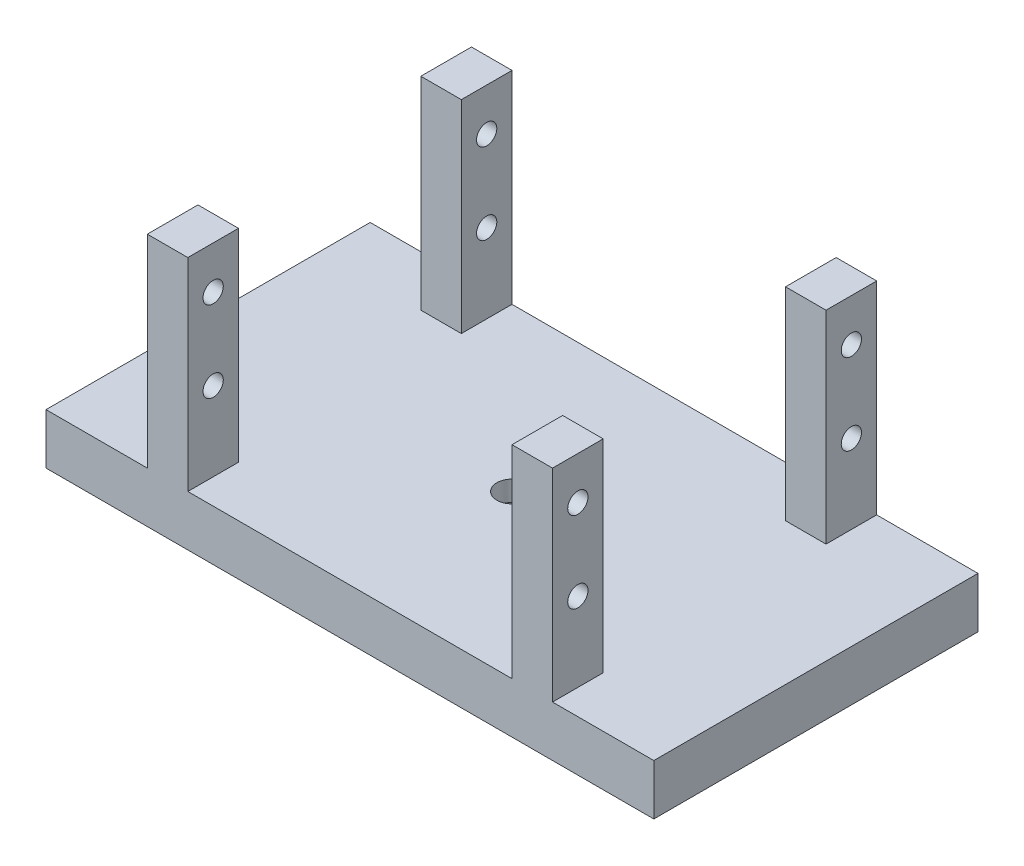
from build123d import *

# Parameters (mm, degrees)
SKETCH1_W           = 60
SKETCH1_H           = 32
SKETCH1_R           = 1.5
BOSS_EXTRUDE1_DEPTH = 5
SKETCH2_R           = 4
CUT_EXTRUDE1_DEPTH  = 3
SKETCH3_W           = 4
SKETCH3_H           = 32
BOSS_EXTRUDE2_DEPTH = 20
SKETCH4_R           = 1
SKETCH4_W           = 22
SKETCH4_H           = 20
CUT_EXTRUDE2_DEPTH  = 59.14636704


with BuildPart() as part:
    # Sketch1 → Boss-Extrude1 (new body)
    with BuildSketch(Plane(origin=(0, 0, 0), x_dir=(1, 0, 0), z_dir=(0, 1, 0))):
        Rectangle(SKETCH1_W, SKETCH1_H)
        with Locations(Location((0, 0, 0), (0, 0, 270))):
            Circle(SKETCH1_R, mode=Mode.SUBTRACT)
    extrude(amount=BOSS_EXTRUDE1_DEPTH)

    # Sketch2 → Cut-Extrude1 (cut)
    with BuildSketch(Plane.XZ):
        with Locations(Location((0, 0, 0), (0, 0, 270))):
            Circle(SKETCH2_R)
    extrude(amount=-CUT_EXTRUDE1_DEPTH, mode=Mode.SUBTRACT)

    # Sketch3 → Boss-Extrude2 (add)
    with BuildSketch(Plane(origin=(0, 5, 0), x_dir=(1, 0, 0), z_dir=(0, 1, 0))):
        with Locations((-18, 0)):
            Rectangle(SKETCH3_W, SKETCH3_H)
        with Locations((18, 0)):
            Rectangle(SKETCH3_W, SKETCH3_H)
    extrude(amount=BOSS_EXTRUDE2_DEPTH)

    # Sketch4 → Cut-Extrude2 (cut, through all)
    with BuildSketch(Plane.ZY.offset(20)):
        with Locations((-13.5, 20.8)):
            Circle(SKETCH4_R)
        with Locations((-13.5, 12.8)):
            Circle(SKETCH4_R)
        with Locations((13.5, 20.8)):
            Circle(SKETCH4_R)
        with Locations((13.5, 12.8)):
            Circle(SKETCH4_R)
        with Locations((0, 15)):
            Rectangle(SKETCH4_W, SKETCH4_H)
    extrude(amount=-CUT_EXTRUDE2_DEPTH, mode=Mode.SUBTRACT)


solid = part.part
